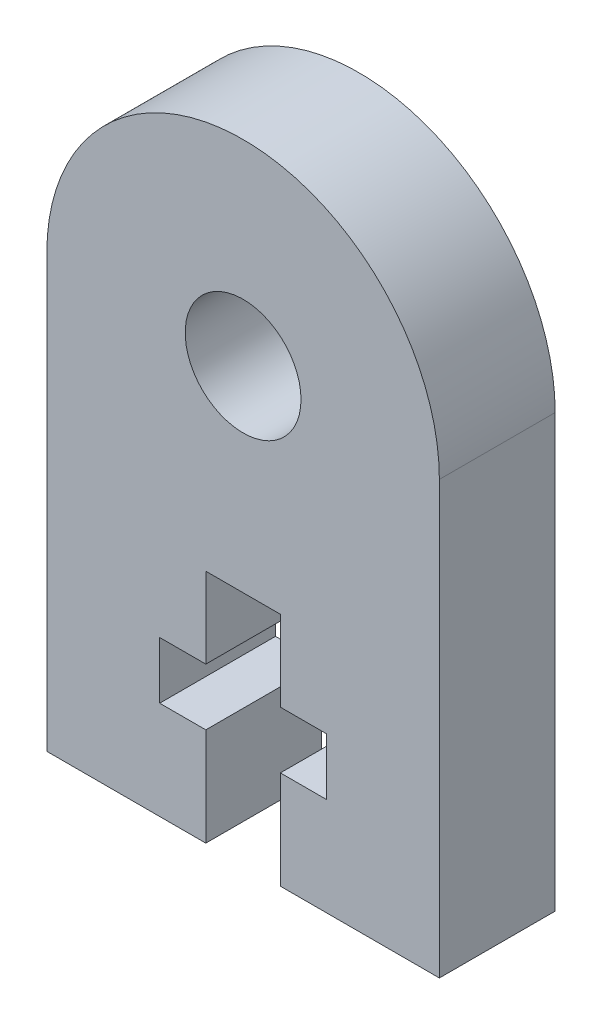
from build123d import *

# Parameters (mm, degrees)
SKETCH1_R           = 2.95
BOSS_EXTRUDE1_DEPTH = 5.9
CUT_EXTRUDE2_DEPTH  = 25.875891944


with BuildPart() as part:
    # Sketch1 → Boss-Extrude1 (new body)
    with BuildSketch(Plane.XY):
        with BuildLine():
            Line((-10, 0), (-10, -22))
            Line((-10, -22), (10, -22))
            Line((10, -22), (10, 0))
            ThreePointArc((10, 0), (0, 10), (-10, 0))
        make_face()
        Circle(SKETCH1_R, mode=Mode.SUBTRACT)
    extrude(amount=BOSS_EXTRUDE1_DEPTH)

    # Sketch3 → Cut-Extrude2 (cut, through all)
    with BuildSketch(Plane.XY.offset(5.9)):
        Polygon((-1.9, -22), (1.9, -22), (1.9, -17), (4.25, -17), (4.25, -14.1), (1.9, -14.1), (1.9, -10), (-1.9, -10), (-1.9, -14.1), (-4.25, -14.1), (-4.25, -17), (-1.9, -17), align=None)
    extrude(amount=-CUT_EXTRUDE2_DEPTH, mode=Mode.SUBTRACT)


solid = part.part
